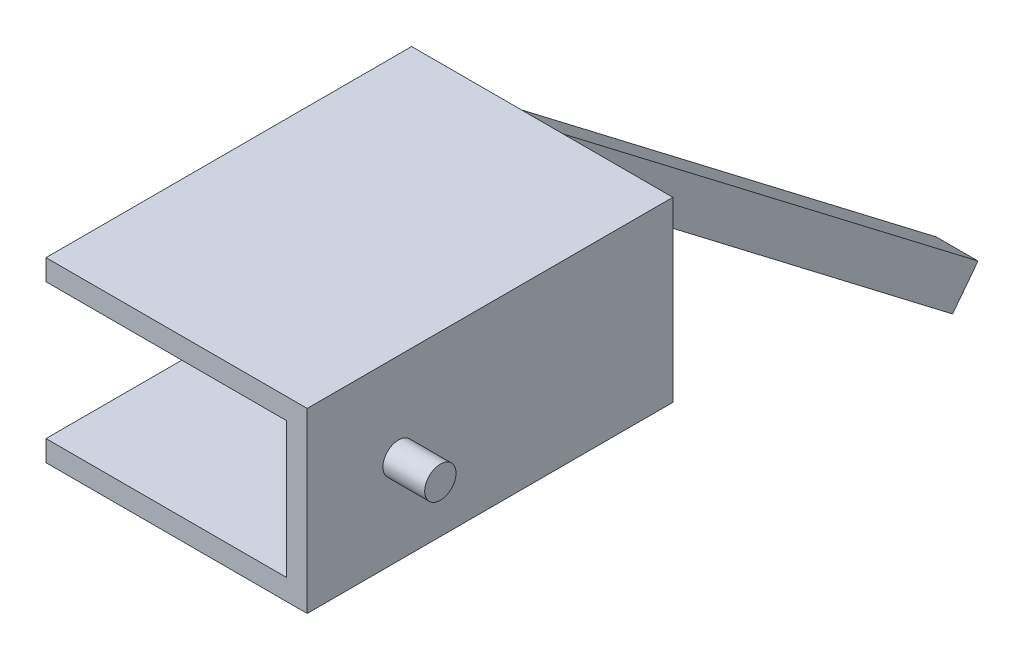
from build123d import *

# Parameters (mm, degrees)
SKETCH2_W           = 25
SKETCH2_H           = 17
BOSS_EXTRUDE1_DEPTH = 35
BOSS_EXTRUDE2_START = -12.5
BOSS_EXTRUDE2_DEPTH = 2
SKETCH4_W           = 26
SKETCH4_H           = 10
CUT_EXTRUDE1_DEPTH  = 10
SKETCH5_W           = 23
SKETCH5_H           = 13
CUT_EXTRUDE2_DEPTH  = 31
SKETCH6_R           = 1.5
BOSS_EXTRUDE4_DEPTH = 4


with BuildPart() as part:
    # Sketch2 → Boss-Extrude1 (new body)
    with BuildSketch(Plane.XY):
        with Locations((0.358490566, 2.41509434)):
            Rectangle(SKETCH2_W, SKETCH2_H)
    extrude(amount=BOSS_EXTRUDE1_DEPTH)

    # Sketch3 → Boss-Extrude2 (add, symmetric)
    with BuildSketch(Plane.ZY.offset(12.141509434).offset(BOSS_EXTRUDE2_START)):
        Polygon((0, 10.91509434), (-39.708579083, -19.469585142), (-37.277804725, -22.646271469), (0, 5.878399383), align=None)
    extrude(amount=BOSS_EXTRUDE2_DEPTH, both=True)

    # Sketch4 → Cut-Extrude1 (cut)
    with BuildSketch(Plane.ZY.offset(12.141509434)):
        with Locations((22, 2.41509434)):
            Rectangle(SKETCH4_W, SKETCH4_H)
    extrude(amount=-CUT_EXTRUDE1_DEPTH, mode=Mode.SUBTRACT)

    # Sketch5 → Cut-Extrude2 (cut)
    with BuildSketch(Plane.XY.offset(35)):
        with Locations((-0.641509434, 2.41509434)):
            Rectangle(SKETCH5_W, SKETCH5_H)
    extrude(amount=-CUT_EXTRUDE2_DEPTH, mode=Mode.SUBTRACT)

    # Sketch6 → Boss-Extrude4 (add)
    with BuildSketch(Plane(origin=(12.858490566, 0, 0), x_dir=(0, 0, -1), z_dir=(1, 0, 0))):
        with Locations(Location((-26.251622056, 2.426562122, 0), (0, 0, 90))):
            Circle(SKETCH6_R)
    extrude(amount=BOSS_EXTRUDE4_DEPTH)


solid = part.part
